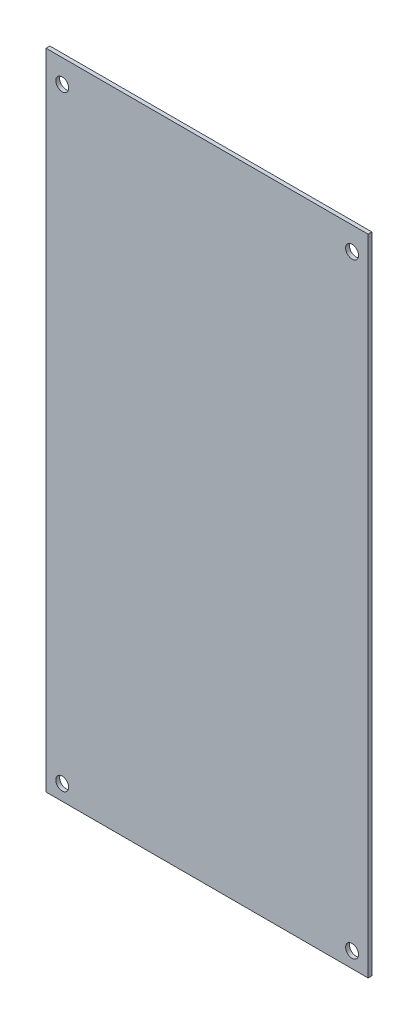
from build123d import *

# Parameters (mm, degrees)
ESQUISSE1_W                          = 250
ESQUISSE1_H                          = 500
BOSS_EXTRU_1_DEPTH                   = 3
ENL_V_MAT_EXTRU_1_REACH              = 561.025
ESQUISSE2_R                          = 5
R_P_TITION_LIN_AIRE1_COUNT           = 2
R_P_TITION_LIN_AIRE1_PITCH           = 225
R_P_TITION_LIN_AIRE2_COUNT           = 2
R_P_TITION_LIN_AIRE2_PITCH           = 470
R_P_TITION_LIN_AIRE2_COPY_1_REACH    = 561.025
R_P_TITION_LIN_AIRE2_COPY_1_SKETCH_R = 5


with BuildPart() as part:
    # Esquisse1 → Boss.-Extru.1 (new body)
    with BuildSketch(Plane.XY):
        with Locations((125, 250)):
            Rectangle(ESQUISSE1_W, ESQUISSE1_H)
    extrude(amount=BOSS_EXTRU_1_DEPTH)

    # Esquisse2 → Enlèv. mat.-Extru.1 (cut, up to next)
    with BuildSketch(Plane.XY.offset(3), mode=Mode.PRIVATE) as enl_v_mat_extru_1_sk1:
        with Locations((12.561884872, 11.993805772)):
            Circle(ESQUISSE2_R)
    enl_v_mat_extru_1_tool1 = extrude(enl_v_mat_extru_1_sk1.sketch, amount=-ENL_V_MAT_EXTRU_1_REACH, mode=Mode.PRIVATE) & part.part
    enl_v_mat_extru_1 = enl_v_mat_extru_1_tool1.solids().sort_by_distance((12.561885, 11.993806, 3))[0]
    add(enl_v_mat_extru_1, mode=Mode.SUBTRACT)

    # Répétition linéaire1: Enlèv. mat.-Extru.1 ×2
    with Locations(*[(i * R_P_TITION_LIN_AIRE1_PITCH, 0, 0) for i in range(1, R_P_TITION_LIN_AIRE1_COUNT)]):
        add(enl_v_mat_extru_1, mode=Mode.SUBTRACT)

    # Répétition linéaire2: Enlèv. mat.-Extru.1 ×2
    with Locations(*[(0, i * R_P_TITION_LIN_AIRE2_PITCH, 0) for i in range(1, R_P_TITION_LIN_AIRE2_COUNT)]):
        add(enl_v_mat_extru_1, mode=Mode.SUBTRACT)

    # Répétition linéaire2 copy 1 sketch → Répétition linéaire2 copy 1 (cut, up to next)
    with BuildSketch(Plane(origin=(225, 470, 3), x_dir=(1, 0, 0), z_dir=(0, 0, 1)), mode=Mode.PRIVATE) as r_p_tition_lin_aire2_copy_1_sk1:
        with Locations((12.561884872, 11.993805772)):
            Circle(R_P_TITION_LIN_AIRE2_COPY_1_SKETCH_R)
    r_p_tition_lin_aire2_copy_1_tool1 = extrude(r_p_tition_lin_aire2_copy_1_sk1.sketch, amount=-R_P_TITION_LIN_AIRE2_COPY_1_REACH, mode=Mode.PRIVATE) & part.part
    add(r_p_tition_lin_aire2_copy_1_tool1.solids().sort_by_distance((237.561885, 481.993806, 3))[0], mode=Mode.SUBTRACT)


solid = part.part
